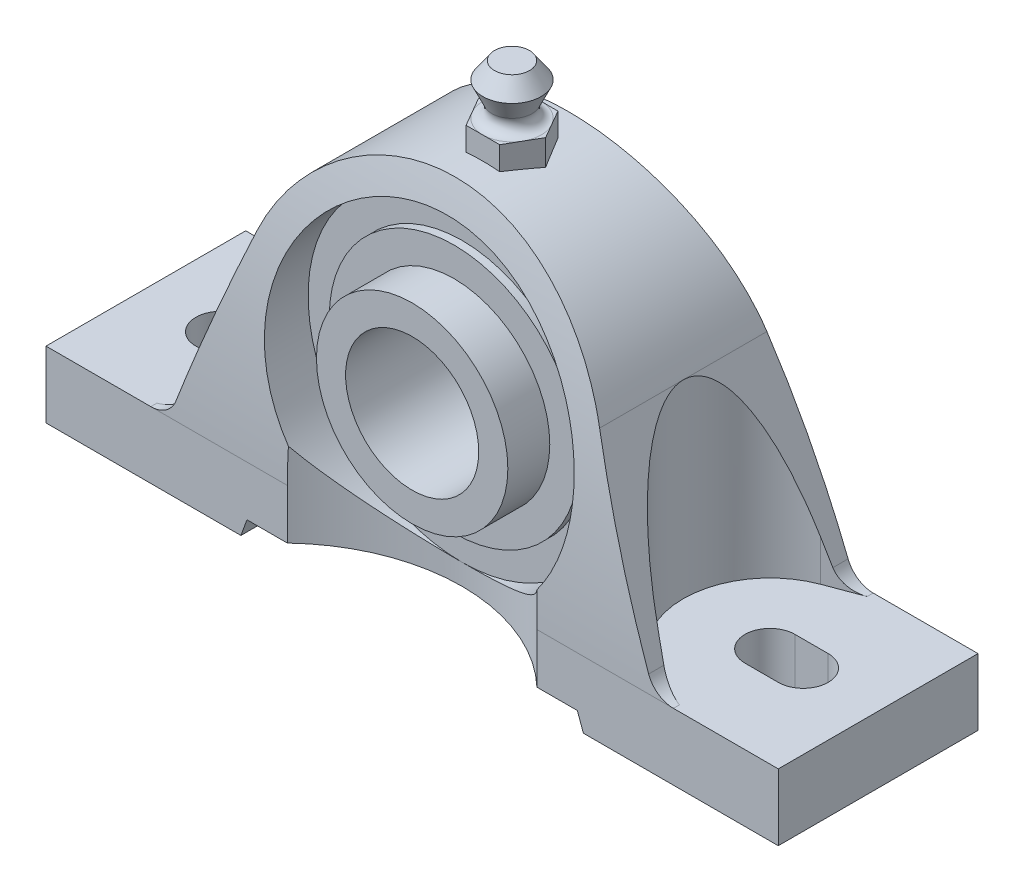
from build123d import *

# Parameters (mm, degrees)
SKETCH2_R                       = 18.25625
EXTRUDE2_DEPTH                  = 19.05
CUT_EXTRUDE1_DEPTH              = 82.086914211
CUT_EXTRUDE1_DEPTH_BACK         = 82.086914211
CUT_EXTRUDE2_START              = -23.8125
CUT_EXTRUDE2_DEPTH              = 36.160471
CUT_EXTRUDE3_DEPTH              = 82.086914211
SKETCH10_R                      = 29.36875
CUT_EXTRUDE5_DEPTH              = 9.525017
CUT_EXTRUDE4_DEPTH              = 36.5125
BOSS_EXTRUDE2_DEPTH             = 11.048983
BOSS_EXTRUDE2_DEPTH_BACK        = 11.048983
SKETCH11_R                      = 23.8125
SKETCH11_R_2                    = 18.25625
SKETCH8_R                       = 18.25625
SKETCH8_R_2                     = 12.7
BOSS_EXTRUDE1_DEPTH             = 34.925
EXTRUDE3_DEPTH                  = 4.7625
EXTRUDE3_DIRECTION_2_REACH      = 103.4
EXTRUDE3_DIRECTION_2_END_RADIUS = 34.925


with BuildPart() as part:
    # Sketch2 → Extrude2 (new, symmetric)
    with BuildSketch(Plane.XY):
        with BuildLine():
            Line((-32.669301174, 12.34797092), (-45.095601647, -20.528568497))
            ThreePointArc((-45.095601647, -20.528568497), (-46.95938885, -22.91164034), (-49.8475, -23.8125))
            Line((-49.8475, -23.8125), (-69.85, -23.8125))
            Line((-69.85, -23.8125), (-69.85, -36.5125))
            Line((-69.85, -36.5125), (-32.669301174, -36.5125))
            Line((-32.669301174, -36.5125), (-31.51369568, -33.3375))
            Line((-31.51369568, -33.3375), (31.51369568, -33.3375))
            Line((31.51369568, -33.3375), (32.669301174, -36.5125))
            Line((32.669301174, -36.5125), (69.85, -36.5125))
            Line((69.85, -36.5125), (69.85, -23.8125))
            Line((69.85, -23.8125), (49.8475, -23.8125))
            ThreePointArc((49.8475, -23.8125), (46.95938885, -22.91164034), (45.095601647, -20.528568497))
            Line((45.095601647, -20.528568497), (32.669301174, 12.34797092))
            ThreePointArc((32.669301174, 12.34797092), (0, 34.925), (-32.669301174, 12.34797092))
        make_face()
        with Locations(Location((0, 0, 0), (0, 0, 180))):
            Circle(SKETCH2_R, mode=Mode.SUBTRACT)
    extrude(amount=EXTRUDE2_DEPTH, both=True)

    # Sketch3 → Cut-Extrude1 (cut, two sides: drawn at the far end of the back side and taken through both)
    with BuildSketch(Plane(origin=(0, 0, 0), x_dir=(1, 0, 0), z_dir=(0, 1, 0)).offset(-CUT_EXTRUDE1_DEPTH_BACK)):
        with BuildLine():
            Line((-55.5625, 4.7625), (-49.2125, 4.7625))
            ThreePointArc((-49.2125, 4.7625), (-44.45, 0), (-49.2125, -4.7625))
            Line((-49.2125, -4.7625), (-55.5625, -4.7625))
            ThreePointArc((-55.5625, -4.7625), (-60.325, 0), (-55.5625, 4.7625))
        make_face()
        with BuildLine():
            Line((49.2125, -4.7625), (55.5625, -4.7625))
            ThreePointArc((55.5625, -4.7625), (60.325, 0), (55.5625, 4.7625))
            Line((55.5625, 4.7625), (49.2125, 4.7625))
            ThreePointArc((49.2125, 4.7625), (44.45, 0), (49.2125, -4.7625))
        make_face()
    extrude(amount=CUT_EXTRUDE1_DEPTH + CUT_EXTRUDE1_DEPTH_BACK, mode=Mode.SUBTRACT)

    # Sketch4 → Cut-Extrude2 (cut)
    with BuildSketch(Plane(origin=(0, 0, 0), x_dir=(1, 0, 0), z_dir=(0, 1, 0)).offset(CUT_EXTRUDE2_START)):
        with BuildLine():
            Line((43.407496446, 15.491267254), (69.85, 25.4))
            Line((69.85, 25.4), (69.85, -25.4))
            Line((69.85, -25.4), (43.407496446, -15.491267254))
            ThreePointArc((43.407496446, -15.491267254), (32.669301174, 0), (43.407496446, 15.491267254))
        make_face()
        with BuildLine():
            Line((-43.407496446, -15.491267254), (-69.85, -25.4))
            Line((-69.85, -25.4), (-69.85, 25.4))
            Line((-69.85, 25.4), (-43.407496446, 15.491267254))
            ThreePointArc((-43.407496446, 15.491267254), (-32.669301174, 0), (-43.407496446, -15.491267254))
        make_face()
    extrude(amount=CUT_EXTRUDE2_DEPTH, mode=Mode.SUBTRACT)

    # Sketch5 → Cut-Extrude3 (cut, symmetric)
    with BuildSketch(Plane(origin=(0, 0, 0), x_dir=(0, 0, -1), z_dir=(1, 0, 0))):
        with BuildLine():
            Line((-10.794982722, 34.925), (-19.05, 34.925))
            Line((-19.05, 34.925), (-19.05, -23.8125))
            ThreePointArc((-19.05, -23.8125), (-16.976154419, 5.84487352), (-10.794982722, 34.925))
        make_face()
    cut_extrude3 = extrude(amount=CUT_EXTRUDE3_DEPTH, both=True, mode=Mode.SUBTRACT)

    # Sketch10 → Cut-Extrude5 (cut)
    with BuildSketch(Plane.XY.offset(19.05)):
        Circle(SKETCH10_R)
    cut_extrude5 = extrude(amount=-CUT_EXTRUDE5_DEPTH, mode=Mode.SUBTRACT)

    # Mirror1: Cut-Extrude3, Cut-Extrude5 across plane
    add(cut_extrude3.mirror(Plane.XY), mode=Mode.SUBTRACT)
    add(cut_extrude5.mirror(Plane.XY), mode=Mode.SUBTRACT)

    # Sketch9 → Cut-Extrude4 (cut)
    with BuildSketch(Plane.XZ.offset(36.5125)):
        with BuildLine():
            Line((23.8125, 19.05), (-23.8125, 19.05))
            ThreePointArc((-23.8125, 19.05), (0, 9.524982722), (23.8125, 19.05))
        make_face()
        with BuildLine():
            Line((23.8125, -19.05), (-23.8125, -19.05))
            ThreePointArc((-23.8125, -19.05), (0, -9.524982722), (23.8125, -19.05))
        make_face()
    extrude(amount=-CUT_EXTRUDE4_DEPTH, mode=Mode.SUBTRACT)

    # Sketch11 → Boss-Extrude2 (add, two sides: drawn at the far end of the back side and taken through both)
    with BuildSketch(Plane.XY.offset(-BOSS_EXTRUDE2_DEPTH_BACK)):
        with Locations(Location((0, 0, 0), (0, 0, 180))):
            Circle(SKETCH11_R)
        with Locations(Location((0, 0, 0), (0, 0, 180))):
            Circle(SKETCH11_R_2, mode=Mode.SUBTRACT)
    extrude(amount=BOSS_EXTRUDE2_DEPTH + BOSS_EXTRUDE2_DEPTH_BACK)



with BuildPart() as body_2:
    # Sketch8 → Boss-Extrude1 (new body)
    with BuildSketch(Plane.XY.offset(19.05)):
        Circle(SKETCH8_R)
        Circle(SKETCH8_R_2, mode=Mode.SUBTRACT)
    extrude(amount=-BOSS_EXTRUDE1_DEPTH)


with BuildPart() as body_3:
    # Sketch6 → Revolve1 (revolve)
    with BuildSketch(Plane.XY, mode=Mode.PRIVATE) as revolve1_sk:
        with BuildLine():
            Line((0, 34.480193023), (-5.55625, 34.480193023))
            Line((-5.55625, 34.480193023), (-5.55625, 39.242693023))
            ThreePointArc((-5.55625, 39.242693023), (-3.965277045, 40.115530676), (-3.846591708, 41.926318986))
            Line((-3.846591708, 41.926318986), (-5.55625, 45.592693023))
            Line((-5.55625, 45.592693023), (-3.333091066, 48.767693023))
            Line((-3.333091066, 48.767693023), (0, 48.767693023))
            Line((0, 48.767693023), (0, 34.480193023))
        make_face()
    revolve(revolve1_sk.sketch.rotate(Axis((0, 34.925, 0), (0, 1, 0)), 180), axis=Axis((0, 34.925, 0), (0, 1, 0)))


with BuildPart() as part_1:
    add(part.part)

    add(body_3.part)  # Extrude3 merges body 3
    # Sketch7 → Extrude3 (add)
    with BuildSketch(Plane.XZ.offset(-34.480193023)):
        Polygon((-3.207902433, 5.55625), (-6.415804866, 0), (-3.207902433, -5.55625), (3.207902433, -5.55625), (6.415804866, 0), (3.207902433, 5.55625), align=None)
    extrude(amount=-EXTRUDE3_DEPTH)

    # Extrude3 direction 2: up to this cylinder (the profile starts outside it)
    extrude3_direction_2_end = Plane(origin=(0, 0, 0), z_dir=(0, 0, -1)) * Cylinder(EXTRUDE3_DIRECTION_2_END_RADIUS, 277.65, mode=Mode.PRIVATE)
    # Sketch7 → Extrude3 direction 2 (add, up to the surface)
    with BuildSketch(Plane.XZ.offset(-34.480193023), mode=Mode.PRIVATE) as extrude3_direction_2_sk1:
        Polygon((-3.207902433, 5.55625), (-6.415804866, 0), (-3.207902433, -5.55625), (3.207902433, -5.55625), (6.415804866, 0), (3.207902433, 5.55625), align=None)
    extrude3_direction_2_tool1 = extrude(extrude3_direction_2_sk1.sketch, amount=EXTRUDE3_DIRECTION_2_REACH, mode=Mode.PRIVATE) - extrude3_direction_2_end
    add(extrude3_direction_2_tool1.solids().sort_by_distance((0, 34.480193, 0))[0])
    add(extrude3_direction_2_tool1.solids().sort_by_distance((0, 34.480193, 0))[1])


solid = Compound([body_2.part, part_1.part])
